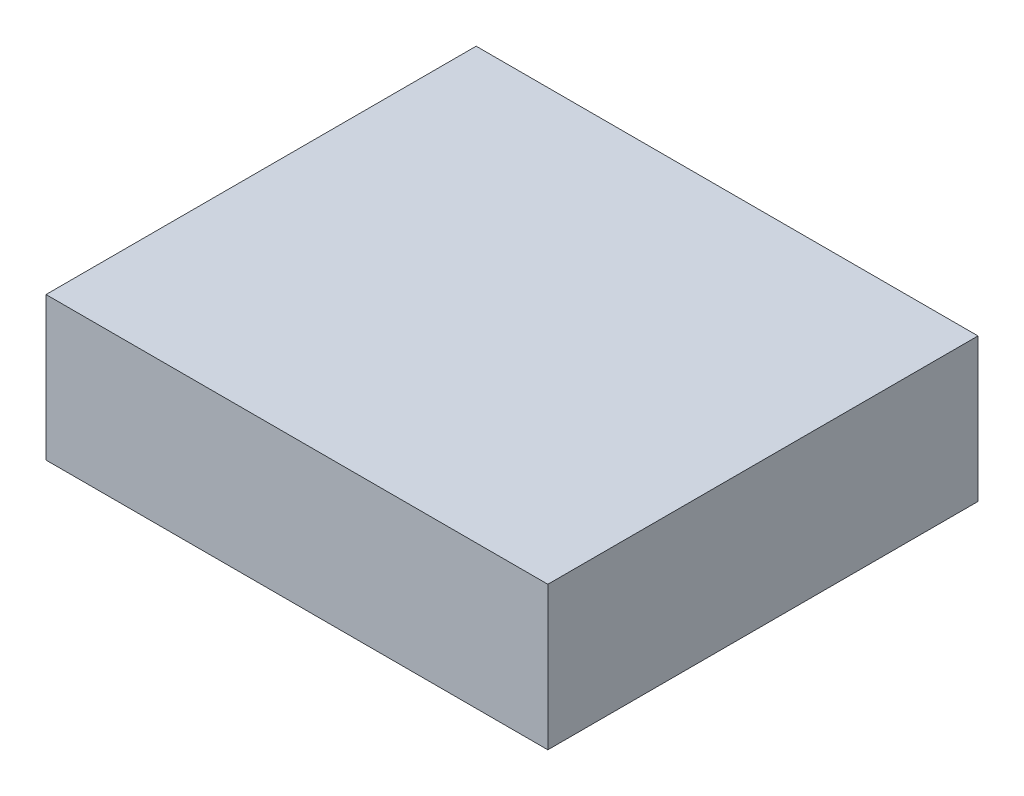
from build123d import *

# Parameters (mm, degrees)
SKETCH1_W           = 177.8
SKETCH1_H           = 152.4
BOSS_EXTRUDE1_DEPTH = 50.8


with BuildPart() as part:
    # Sketch1 → Boss-Extrude1 (new body)
    with BuildSketch(Plane(origin=(0, 0, 0), x_dir=(1, 0, 0), z_dir=(0, 1, 0))):
        with Locations((14.212852665, -45.451933124)):
            Rectangle(SKETCH1_W, SKETCH1_H)
    extrude(amount=BOSS_EXTRUDE1_DEPTH)


solid = part.part
